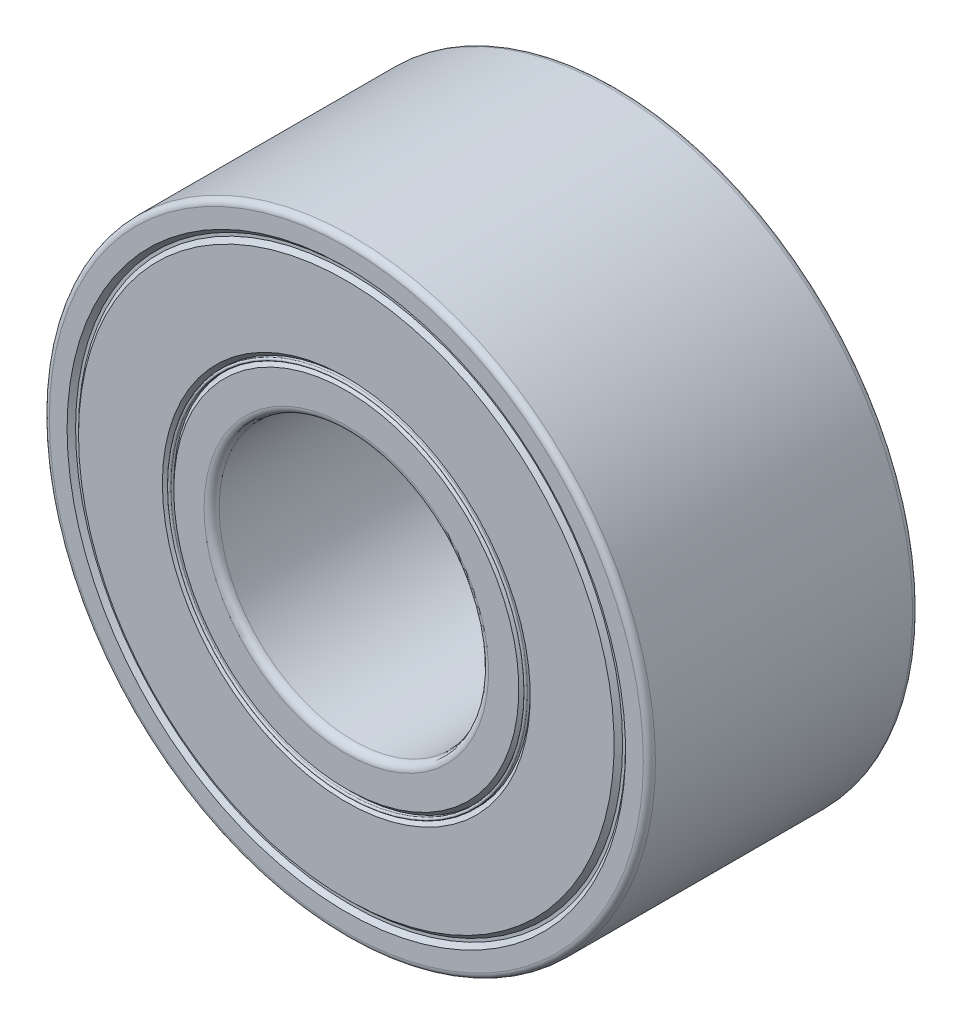
from build123d import *

# Parameters (mm, degrees)
SKETCH3_W         = 4
SKETCH3_H         = 0.416666667
SKETCH3_H_2       = 0.625
SKETCH4_R         = 0.875
CIRPATTERN1_COUNT = 9
FILLET1_R         = 0.09
FILLET2_R         = 0.1125
CHAMFER1_SIZE     = 0.063
CHAMFER2_SIZE     = 0.063


with BuildPart() as part:
    # Sketch3 → Revolve1 (revolve)
    with BuildSketch(Plane(origin=(0, 0, 0), x_dir=(0, 0, -1), z_dir=(1, 0, 0)), mode=Mode.PRIVATE) as revolve1_sk:
        with Locations((0, -4.291666667)):
            Rectangle(SKETCH3_W, SKETCH3_H)
        with Locations((0, -2.3125)):
            Rectangle(SKETCH3_W, SKETCH3_H_2)
    revolve(revolve1_sk.sketch.rotate(Axis((0, 0, -2), (0, 0, 1)), 270), axis=Axis((0, 0, -2), (0, 0, 1)))

    # Sketch4 → Cut-Revolve1 (revolve, cut)
    with BuildSketch(Plane(origin=(0, 0, 0), x_dir=(0, 0, -1), z_dir=(1, 0, 0)), mode=Mode.PRIVATE) as cut_revolve1_sk:
        with Locations((0, -3.354166667)):
            Circle(SKETCH4_R)
    revolve(cut_revolve1_sk.sketch.rotate(Axis((0, 0, -2), (0, 0, 1)), 270), axis=Axis((0, 0, -2), (0, 0, 1)), mode=Mode.SUBTRACT)

    # Fillet1
    fillet1_edges = [part.edges().sort_by_distance(p)[0] for p in [
        (4.5, 0, -2),
        (4.5, 0, 2),
    ]]
    fillet(fillet1_edges, radius=FILLET1_R)

    # Fillet2
    fillet2_edges = [part.edges().sort_by_distance(p)[0] for p in [
        (2, 0, -2),
        (2, 0, 2),
    ]]
    fillet(fillet2_edges, radius=FILLET2_R)

    # Chamfer1
    chamfer1_edges = [part.edges().sort_by_distance(p)[0] for p in [
        (4.083333333, 0, 2),
        (4.083333333, 0, -2),
    ]]
    chamfer(chamfer1_edges, length=CHAMFER1_SIZE)

    # Chamfer2
    chamfer2_edges = [part.edges().sort_by_distance(p)[0] for p in [
        (2.625, 0, 2),
        (2.625, 0, -2),
    ]]
    chamfer(chamfer2_edges, length=CHAMFER2_SIZE)


with BuildPart() as body_2:
    # Sketch5 → Revolve2 (revolve)
    with BuildSketch(Plane(origin=(0, 0, 0), x_dir=(0, 0, -1), z_dir=(1, 0, 0))):
        with BuildLine():
            Line((0, -2.479166667), (0, -4.229166667))
            ThreePointArc((0, -4.229166667), (0.875, -3.354166667), (0, -2.479166667))
        make_face()
    revolve(axis=Axis((0, -2.479166667, 0), (0, -1, 0)))


with BuildPart() as cirpattern1_1:
    # CirPattern1: pattern copy
    add(body_2.part.rotate(Axis((0, 0, 0), (0, 0, 1)), 1 * 360 / CIRPATTERN1_COUNT))


with BuildPart() as cirpattern1_2:
    # CirPattern1: pattern copy
    add(body_2.part.rotate(Axis((0, 0, 0), (0, 0, 1)), 2 * 360 / CIRPATTERN1_COUNT))


with BuildPart() as cirpattern1_3:
    # CirPattern1: pattern copy
    add(body_2.part.rotate(Axis((0, 0, 0), (0, 0, 1)), 3 * 360 / CIRPATTERN1_COUNT))


with BuildPart() as cirpattern1_4:
    # CirPattern1: pattern copy
    add(body_2.part.rotate(Axis((0, 0, 0), (0, 0, 1)), 4 * 360 / CIRPATTERN1_COUNT))


with BuildPart() as cirpattern1_5:
    # CirPattern1: pattern copy
    add(body_2.part.rotate(Axis((0, 0, 0), (0, 0, 1)), 5 * 360 / CIRPATTERN1_COUNT))


with BuildPart() as cirpattern1_6:
    # CirPattern1: pattern copy
    add(body_2.part.rotate(Axis((0, 0, 0), (0, 0, 1)), 6 * 360 / CIRPATTERN1_COUNT))


with BuildPart() as cirpattern1_7:
    # CirPattern1: pattern copy
    add(body_2.part.rotate(Axis((0, 0, 0), (0, 0, 1)), 7 * 360 / CIRPATTERN1_COUNT))


with BuildPart() as cirpattern1_8:
    # CirPattern1: pattern copy
    add(body_2.part.rotate(Axis((0, 0, 0), (0, 0, 1)), 8 * 360 / CIRPATTERN1_COUNT))


with BuildPart() as body_11:
    # Sketch6 → Revolve3 (revolve)
    with BuildSketch(Plane(origin=(0, 0, 0), x_dir=(0, 0, -1), z_dir=(1, 0, 0)), mode=Mode.PRIVATE) as revolve3_sk:
        Polygon((-2, -2.73175), (-2, -3.976583333), (-1.937, -4.039583333), (-1.937, -4.083333333), (-0.875, -4.083333333), (-0.875, -2.625), (-1.937, -2.625), (-1.937, -2.66875), align=None)
        Polygon((1.937, -4.083333333), (0.875, -4.083333333), (0.875, -2.625), (1.937, -2.625), (1.937, -2.66875), (2, -2.73175), (2, -3.976583333), (1.937, -4.039583333), align=None)
    revolve(revolve3_sk.sketch.rotate(Axis((0, 0, -2), (0, 0, 1)), 270), axis=Axis((0, 0, -2), (0, 0, 1)))


with BuildPart() as body_12:
    # Sketch7 → Revolve4 (revolve)
    with BuildSketch(Plane(origin=(0, 0, 0), x_dir=(0, 0, -1), z_dir=(1, 0, 0)), mode=Mode.PRIVATE) as revolve4_sk:
        with BuildLine():
            Line((-1.937, -2.66875), (-1.937, -2.625))
            Line((-1.937, -2.625), (-1.978125, -2.625))
            ThreePointArc((-1.978125, -2.625), (-2, -2.646875), (-1.978125, -2.66875))
            Line((-1.978125, -2.66875), (-1.937, -2.66875))
        make_face()
        with BuildLine():
            Line((1.937, -2.625), (1.978125, -2.625))
            ThreePointArc((1.978125, -2.625), (2, -2.646875), (1.978125, -2.66875))
            Line((1.978125, -2.66875), (1.937, -2.66875))
            Line((1.937, -2.66875), (1.937, -2.625))
        make_face()
    revolve(revolve4_sk.sketch.rotate(Axis((0, 0, -2), (0, 0, 1)), 270), axis=Axis((0, 0, -2), (0, 0, 1)))


solid = Compound([part.part, body_2.part, cirpattern1_1.part, cirpattern1_2.part, cirpattern1_3.part, cirpattern1_4.part, cirpattern1_5.part, cirpattern1_6.part, cirpattern1_7.part, cirpattern1_8.part, body_11.part, body_12.part])
